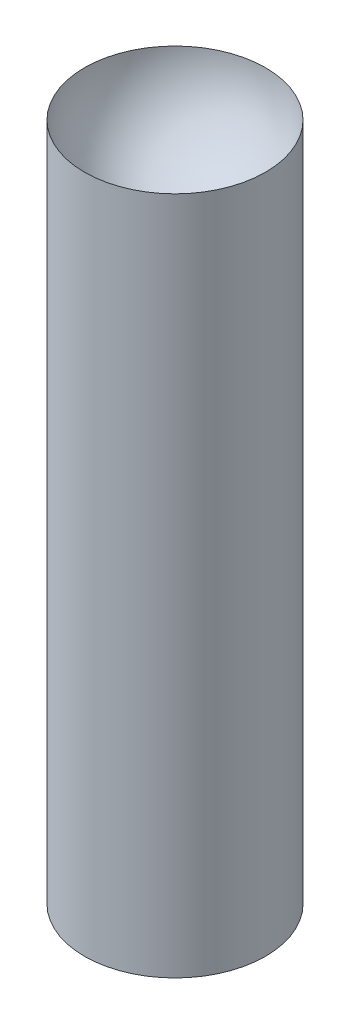
from build123d import *

# Parameters (mm, degrees)
SKETCH1_R           = 10.16
BOSS_EXTRUDE1_DEPTH = 76.2


with BuildPart() as part:
    # Sketch1 → Boss-Extrude1 (new body)
    with BuildSketch(Plane(origin=(0, 0, 0), x_dir=(1, 0, 0), z_dir=(0, 1, 0))):
        with Locations(Location((0, 0, 0), (0, 0, 90))):
            Circle(SKETCH1_R)
    extrude(amount=BOSS_EXTRUDE1_DEPTH)

    # Sketch2 → Cut-Revolve1 (revolve, cut)
    with BuildSketch(Plane(origin=(0, 76.2, 0), x_dir=(1, 0, 0), z_dir=(0, 1, 0))):
        with BuildLine():
            Line((0, 10.16), (0, -10.16))
            ThreePointArc((0, -10.16), (10.16, 0), (0, 10.16))
        make_face()
    revolve(axis=Axis((0, 76.2, -10.16), (0, 0, 1)), mode=Mode.SUBTRACT)


solid = part.part
